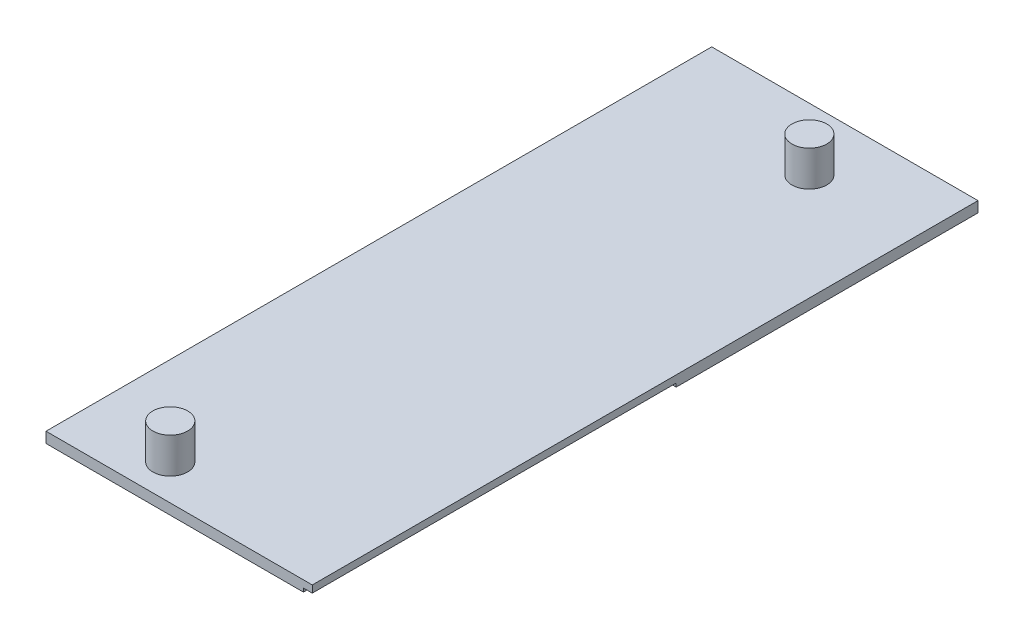
from build123d import *

# Parameters (mm, degrees)
SKETCH1_W           = 75
SKETCH1_H           = 3
BOSS_EXTRUDE1_DEPTH = 187.5
SKETCH2_R           = 4.9
BOSS_EXTRUDE2_DEPTH = 10
SKETCH3_W           = 7
SKETCH3_H           = 33
SKETCH3_W_2         = 2.5
SKETCH3_H_2         = 102.5
CUT_EXTRUDE1_DEPTH  = 1


with BuildPart() as part:
    # Sketch1 → Boss-Extrude1 (new body)
    with BuildSketch(Plane.XY):
        with Locations((37.5, 1.5)):
            Rectangle(SKETCH1_W, SKETCH1_H)
    extrude(amount=BOSS_EXTRUDE1_DEPTH)

    # Sketch2 → Boss-Extrude2 (add)
    with BuildSketch(Plane(origin=(0, 3, 0), x_dir=(1, 0, 0), z_dir=(0, 1, 0))):
        with Locations(Location((25, -177.5, 0), (0, 0, 90))):
            Circle(SKETCH2_R)
        with Locations(Location((45, -17.5, 0), (0, 0, 90))):
            Circle(SKETCH2_R)
    extrude(amount=BOSS_EXTRUDE2_DEPTH)

    # Sketch3 → Cut-Extrude1 (cut)
    with BuildSketch(Plane.XZ):
        with Locations((7.5, 26.5)):
            Rectangle(SKETCH3_W, SKETCH3_H)
        with Locations((7.5, 63.5)):
            Rectangle(SKETCH3_W, SKETCH3_H)
        with Locations((22.5, 26.5)):
            Rectangle(SKETCH3_W, SKETCH3_H)
        with Locations((22.5, 63.5)):
            Rectangle(SKETCH3_W, SKETCH3_H)
        with Locations((37.5, 26.5)):
            Rectangle(SKETCH3_W, SKETCH3_H)
        with Locations((37.5, 63.5)):
            Rectangle(SKETCH3_W, SKETCH3_H)
        with Locations((52.5, 26.5)):
            Rectangle(SKETCH3_W, SKETCH3_H)
        with Locations((52.5, 63.5)):
            Rectangle(SKETCH3_W, SKETCH3_H)
        with Locations((67.5, 26.5)):
            Rectangle(SKETCH3_W, SKETCH3_H)
        with Locations((67.5, 63.5)):
            Rectangle(SKETCH3_W, SKETCH3_H)
        with Locations((73.75, 136.25)):
            Rectangle(SKETCH3_W_2, SKETCH3_H_2)
    extrude(amount=-CUT_EXTRUDE1_DEPTH, mode=Mode.SUBTRACT)


solid = part.part
